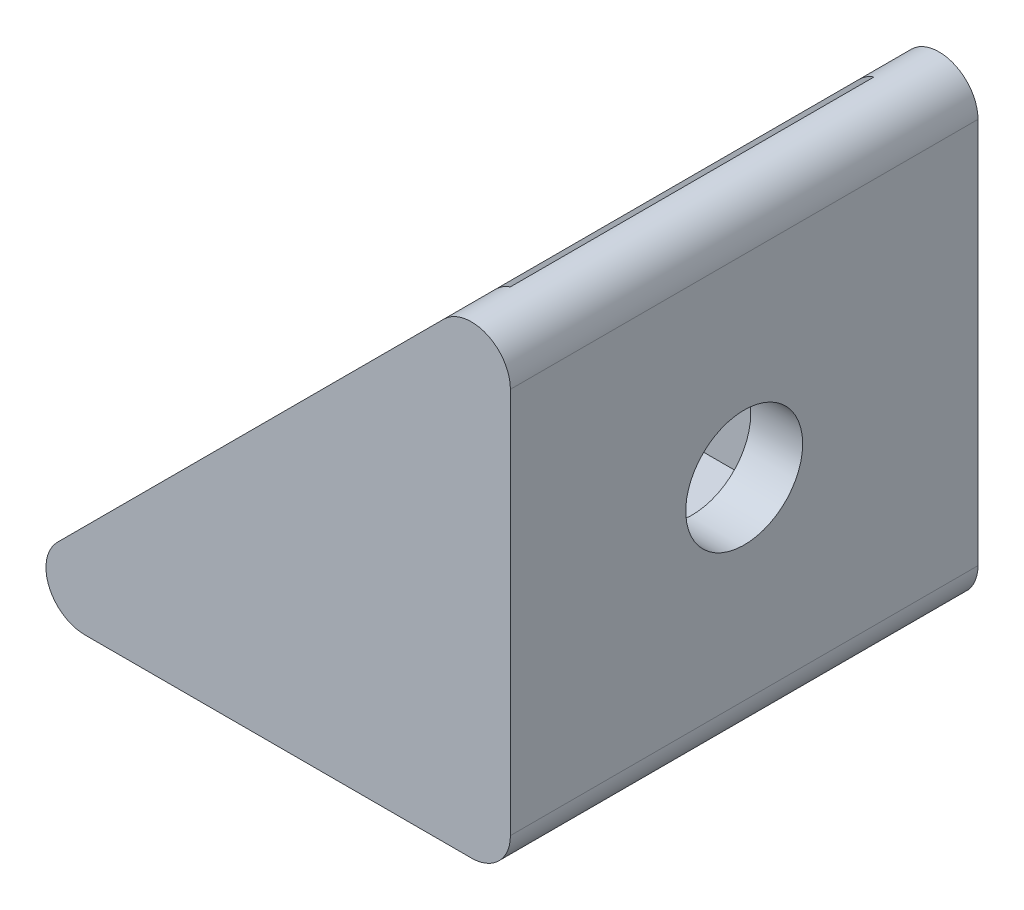
from build123d import *

# Parameters (mm, degrees)
BOSS_EXTRU_1_DEPTH      = 18
ENL_V_START             = -2
ESQUISSE2_W             = 17.221313325
ESQUISSE2_H             = 14
ENL_V_MAT_EXTRU_1_DEPTH = 30.036983947
D_GAGEMENT_M41_D        = 4.5
D_GAGEMENT_M42_D        = 4.5


with BuildPart() as part:
    # Esquisse1 → Boss.-Extru.1 (new body)
    with BuildSketch(Plane.XY):
        with BuildLine():
            Line((0, 1.5), (0, 16.378679656))
            ThreePointArc((0, 16.378679656), (-0.925974851, 17.764498955), (-2.560660172, 17.439339828))
            Line((-2.560660172, 17.439339828), (-17.439339828, 2.560660172))
            ThreePointArc((-17.439339828, 2.560660172), (-17.764498955, 0.925974851), (-16.378679656, 0))
            Line((-16.378679656, 0), (-1.5, 0))
            ThreePointArc((-1.5, 0), (-0.439339828, 0.439339828), (0, 1.5))
        make_face()
    extrude(amount=BOSS_EXTRU_1_DEPTH)

    # Esquisse2 → Enlèv. mat.-Extru.1 (cut, through all)
    with BuildSketch(Plane.XZ.offset(ENL_V_START)):
        with Locations((-10.610656663, 9)):
            Rectangle(ESQUISSE2_W, ESQUISSE2_H)
    extrude(amount=-ENL_V_MAT_EXTRU_1_DEPTH, mode=Mode.SUBTRACT)

    # Dégagement M41 (through all)
    with Locations(Plane(origin=(0, 0, 0), x_dir=(0, 0, -1), z_dir=(1, 0, 0))):
        with Locations((-9, 8.939339828)):
            Hole(D_GAGEMENT_M41_D / 2)

    # Dégagement M42 (through all)
    with Locations(Plane(origin=(0, 0, 0), x_dir=(-1, 0, 0), z_dir=(0, -1, 0))):
        with Locations((8.939339828, -9)):
            Hole(D_GAGEMENT_M42_D / 2)


solid = part.part
